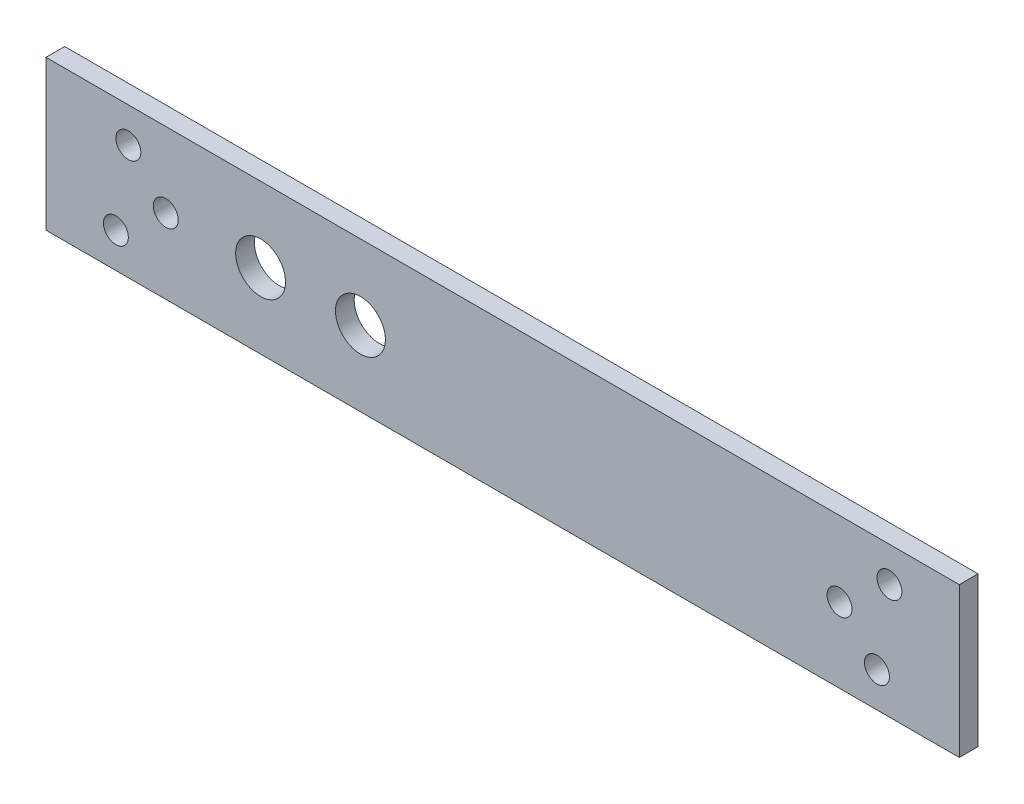
from build123d import *

# Parameters (mm, degrees)
SKETCH1_W           = 232.41
SKETCH1_H           = 38.1
SKETCH1_R           = 3.175
SKETCH1_R_2         = 6.35
BOSS_EXTRUDE1_DEPTH = 4.7625


with BuildPart() as part:
    # Sketch1 → Boss-Extrude1 (new body)
    with BuildSketch(Plane.XY):
        with Locations((116.205, 19.05)):
            Rectangle(SKETCH1_W, SKETCH1_H)
        with Locations(Location((30.48, 19.05, 0), (0, 0, 180))):
            Circle(SKETCH1_R, mode=Mode.SUBTRACT)
        with Locations(Location((80.01, 19.05, 0), (0, 0, 180))):
            Circle(SKETCH1_R_2, mode=Mode.SUBTRACT)
        with Locations(Location((20.955, 29.21, 0), (0, 0, 180))):
            Circle(SKETCH1_R, mode=Mode.SUBTRACT)
        with Locations(Location((17.78, 8.89, 0), (0, 0, 180))):
            Circle(SKETCH1_R, mode=Mode.SUBTRACT)
        with Locations(Location((214.63, 29.21, 0), (0, 0, 180))):
            Circle(SKETCH1_R, mode=Mode.SUBTRACT)
        with Locations(Location((201.93, 19.05, 0), (0, 0, 180))):
            Circle(SKETCH1_R, mode=Mode.SUBTRACT)
        with Locations(Location((211.455, 8.89, 0), (0, 0, 180))):
            Circle(SKETCH1_R, mode=Mode.SUBTRACT)
        with Locations(Location((54.61, 19.05, 0), (0, 0, 180))):
            Circle(SKETCH1_R_2, mode=Mode.SUBTRACT)
    extrude(amount=BOSS_EXTRUDE1_DEPTH)


solid = part.part
